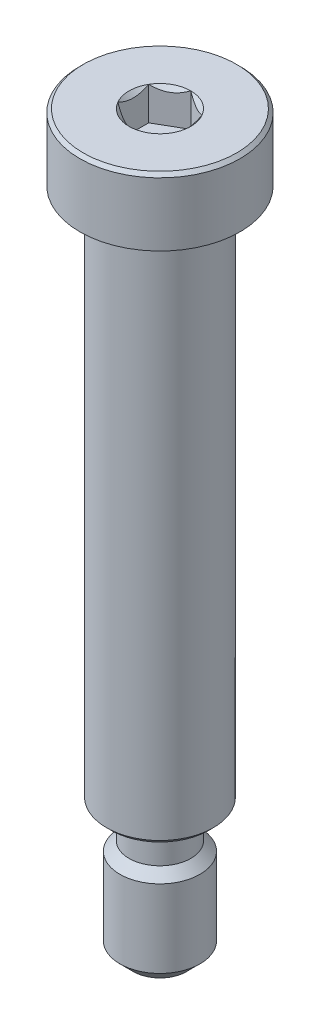
from build123d import *

# Parameters (mm, degrees)
SKETCH1_R          = 9.525
EXTRUDE1_DEPTH     = 7.9375
CUT_EXTRUDE1_DEPTH = 3.96875
SKETCH18_R         = 3.666174209
CUT_EXTRUDE4_DEPTH = 1.322916667
CUT_EXTRUDE4_DRAFT = -45
SKETCH4_R          = 6.35
EXTRUDE2_DEPTH     = 63.5
SKETCH5_R          = 4.7625
EXTRUDE3_DEPTH     = 15.875
CHAMFER1_SIZE      = 1.5875
CHAMFER2_SIZE      = 0.529166667
CHAMFER3_SIZE      = 0.396875


with BuildPart() as part:
    # Sketch1 → Extrude1 (new body)
    with BuildSketch(Plane(origin=(0, 0, 0), x_dir=(1, 0, 0), z_dir=(0, 1, 0))):
        Circle(SKETCH1_R)
    extrude(amount=EXTRUDE1_DEPTH)

    # Sketch2 → Cut-Extrude1 (cut)
    with BuildSketch(Plane(origin=(0, 7.9375, 0), x_dir=(-1, 0, 0), z_dir=(0, 1, 0))):
        Polygon((0, -3.666174209), (3.175, -1.833087105), (3.175, 1.833087105), (0, 3.666174209), (-3.175, 1.833087105), (-3.175, -1.833087105), align=None)
    extrude(amount=-CUT_EXTRUDE1_DEPTH, mode=Mode.SUBTRACT)


with BuildPart() as cut_extrude4_tool:
    # Sketch18 → Cut-Extrude4 (with draft: the straight prism first)
    with BuildSketch(Plane(origin=(0, 7.9375, 0), x_dir=(1, 0, 0), z_dir=(0, 1, 0))):
        Circle(SKETCH18_R)
    extrude(amount=-CUT_EXTRUDE4_DEPTH)
    # Cut-Extrude4: the draft: its side faces are tilted about the plane it starts from
    cut_extrude4_sides = [cut_extrude4_tool.faces().sort_by_distance(p)[0] for p in [
        (-3.666174209, 7.276041667, 0),
    ]]
    draft(cut_extrude4_sides, Plane(origin=(0, 7.9375, 0), x_dir=(1, 0, 0), z_dir=(0, 1, 0)), CUT_EXTRUDE4_DRAFT)


with BuildPart() as part_1:
    add(part.part)

    # Cut-Extrude4: cut by cut_extrude4_tool
    add(cut_extrude4_tool.part, mode=Mode.SUBTRACT)

    # Sketch4 → Extrude2 (add)
    with BuildSketch(Plane.XZ.offset(63.5)):
        Circle(SKETCH4_R)
    extrude(amount=-EXTRUDE2_DEPTH)

    # Sketch5 → Extrude3 (add)
    with BuildSketch(Plane.XZ.offset(63.5)):
        Circle(SKETCH5_R)
    extrude(amount=EXTRUDE3_DEPTH)

    # Chamfer1
    chamfer1_edges = [part_1.edges().sort_by_distance(p)[0] for p in [
        (-4.7625, -79.375, 0),
    ]]
    chamfer(chamfer1_edges, length=CHAMFER1_SIZE)

    # Sketch17 → Cut-Revolve1 (revolve, cut)
    with BuildSketch(Plane.XY):
        with BuildLine():
            Line((4.862800608, -63.5), (6.35, -63.5))
            Line((6.35, -63.5), (6.35, -67.46875))
            Line((6.35, -67.46875), (6.35, -70.146574392))
            Line((6.35, -70.146574392), (3.672175608, -67.46875))
            Line((3.672175608, -67.46875), (3.672175608, -64.690625))
            ThreePointArc((3.672175608, -64.690625), (4.020901597, -63.848725989), (4.862800608, -63.5))
        make_face()
    revolve(axis=Axis((0, 0, 0), (0, -1, 0)), mode=Mode.SUBTRACT)

    # Chamfer2
    chamfer2_edges = [part_1.edges().sort_by_distance(p)[0] for p in [
        (-6.35, -63.5, 0),
    ]]
    chamfer(chamfer2_edges, length=CHAMFER2_SIZE)

    # Chamfer3
    chamfer3_edges = [part_1.edges().sort_by_distance(p)[0] for p in [
        (-9.525, 7.9375, 0),
    ]]
    chamfer(chamfer3_edges, length=CHAMFER3_SIZE)


solid = part_1.part
